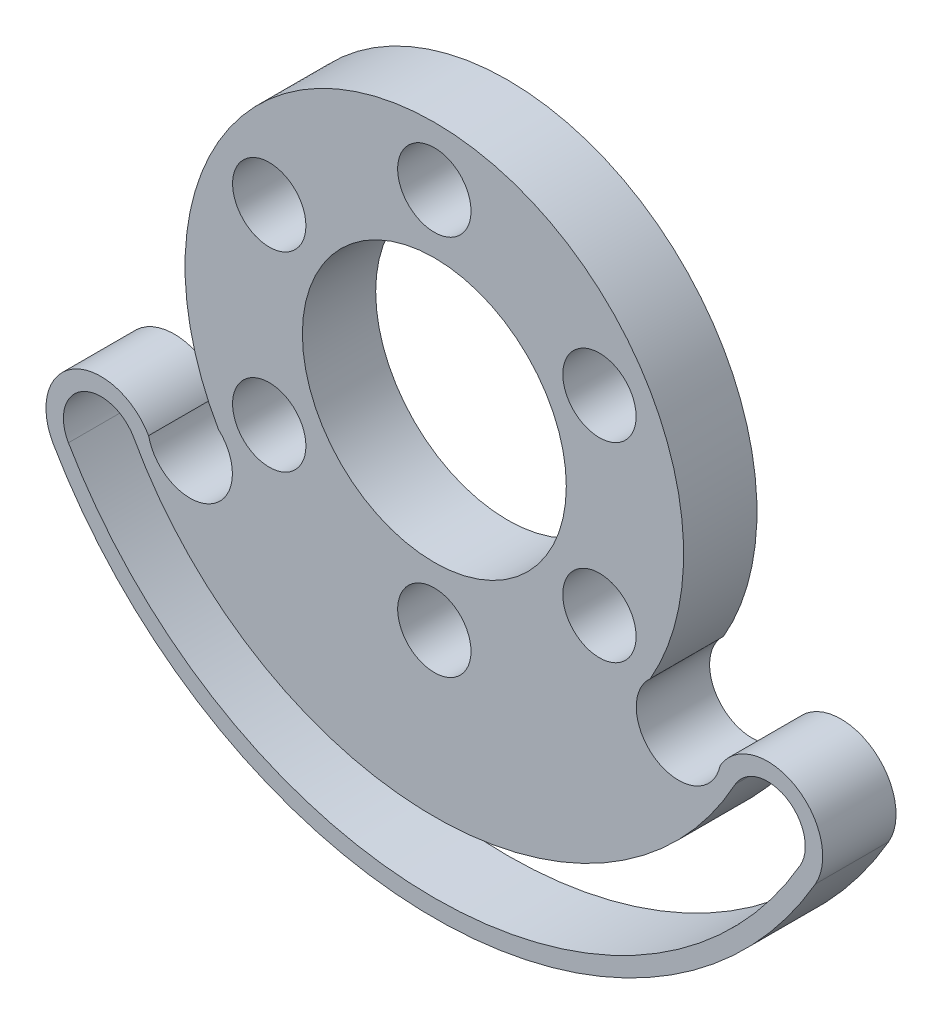
from build123d import *

# Parameters (mm, degrees)
SKETCH2_R           = 5
SKETCH2_R_2         = 18
BOSS_EXTRUDE1_DEPTH = 10


with BuildPart() as part:
    # Sketch2 → Boss-Extrude1 (new body)
    with BuildSketch(Plane.XY):
        with BuildLine():
            ThreePointArc((29.444863729, -17), (0, 34), (-29.444863729, -17))
            ThreePointArc((-29.444863729, -17), (-30.432675575, -26.289059694), (-38.97114317, -22.5))
            ThreePointArc((-38.97114317, -22.5), (-49.216333699, -19.754809472), (-51.961524227, -30))
            ThreePointArc((-51.961524227, -30), (0, -60), (51.961524227, -30))
            ThreePointArc((51.961524227, -30), (49.216333699, -19.754809472), (38.97114317, -22.5))
            ThreePointArc((38.97114317, -22.5), (30.429409054, -26.294717474), (29.444863729, -17))
        make_face()
        with Locations((22.516660498, -13)):
            Circle(SKETCH2_R, mode=Mode.SUBTRACT)
        with Locations((0, -26)):
            Circle(SKETCH2_R, mode=Mode.SUBTRACT)
        with Locations((-22.516660498, -13)):
            Circle(SKETCH2_R, mode=Mode.SUBTRACT)
        with Locations((-22.516660498, 13)):
            Circle(SKETCH2_R, mode=Mode.SUBTRACT)
        with Locations((0, 26)):
            Circle(SKETCH2_R, mode=Mode.SUBTRACT)
        with Locations((22.516660498, 13)):
            Circle(SKETCH2_R, mode=Mode.SUBTRACT)
        with BuildLine():
            ThreePointArc((-49.903995186, -28.812085055), (-48.028418753, -21.812338512), (-41.028672211, -23.687914945))
            ThreePointArc((-41.028672211, -23.687914945), (0, -48.031541814), (41.028672211, -23.687914945))
            ThreePointArc((41.028672211, -23.687914945), (48.028418753, -21.812338512), (49.903995186, -28.812085055))
            ThreePointArc((49.903995186, -28.812085055), (0, -57.624170109), (-49.903995186, -28.812085055))
        make_face(mode=Mode.SUBTRACT)
        Circle(SKETCH2_R_2, mode=Mode.SUBTRACT)
    extrude(amount=-BOSS_EXTRUDE1_DEPTH)


solid = part.part
